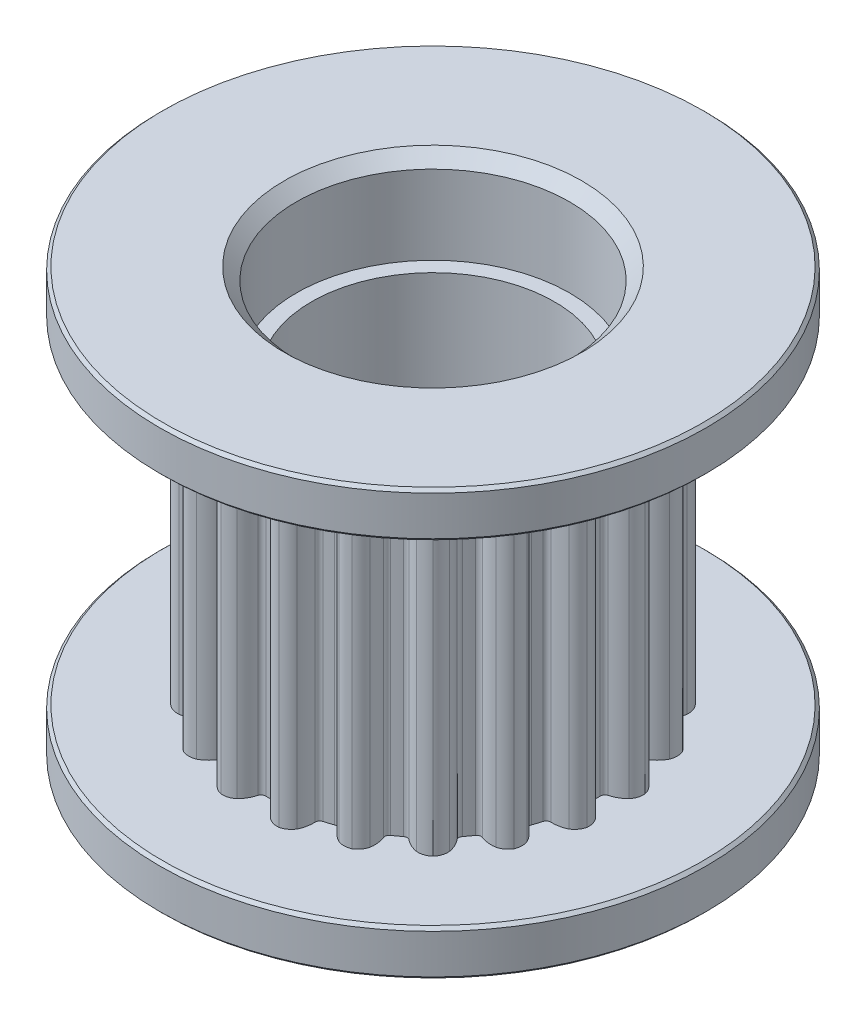
from build123d import *

# Parameters (mm, degrees)
GT2_PROFILE_REACH                 = 16.526
GT2_PROFILE_DIRECTION_2_REACH     = 16.526
GT2_GROOVE_CIRCULAR_PATTERN_COUNT = 20
INNER_CHAMFER_SIZE                = 0.4
OUTER_CHAMFER_SIZE                = 0.1


with BuildPart() as part:
    # Body Sketch → Body (revolve)
    with BuildSketch(Plane.XY, mode=Mode.PRIVATE) as body_sk:
        Polygon((6.11, -5.5), (6.11, 5.5), (9, 5.5), (9, 7), (4.5, 7), (4.5, 4), (4, 4), (4, -4), (4.5, -4), (4.5, -7), (9, -7), (9, -5.5), align=None)
    revolve(body_sk.sketch.rotate(Axis((0, 7, 0), (0, -1, 0)), 90), axis=Axis((0, 7, 0), (0, -1, 0)))

    # GT2 Profile: up to this face of the body (flat: up to its plane)
    gt2_profile_end = Plane(part.part.faces().sort_by_distance((0, -5.5, -8.745441559))[0])
    # GT2 Profile Sketch → GT2 Profile (cut, up to the picked face)
    with BuildSketch(Plane(origin=(0, 0, 0), x_dir=(1, 0, 0), z_dir=(0, 1, 0)), mode=Mode.PRIVATE) as gt2_profile_sk1:
        with BuildLine():
            ThreePointArc((0.299749921, -5.468781955), (0.244461347, -5.387479579), (0.150701934, -5.357881011))
            ThreePointArc((0.150701934, -5.357881011), (0, -5.36), (-0.150701934, -5.357881011))
            ThreePointArc((-0.150701934, -5.357881011), (-0.244461347, -5.387479579), (-0.299749921, -5.468781955))
            ThreePointArc((-0.299749921, -5.468781955), (-0.396626607, -5.703924717), (-0.549685833, -5.907025885))
            ThreePointArc((-0.549685833, -5.907025885), (-0.7593874, -6.016293358), (-0.995541542, -6.028349446))
            ThreePointArc((-0.995541542, -6.028349446), (0, -6.11), (0.995541542, -6.028349446))
            ThreePointArc((0.995541542, -6.028349446), (0.7593874, -6.016293358), (0.549685833, -5.907025885))
            ThreePointArc((0.549685833, -5.907025885), (0.396626607, -5.703924717), (0.299749921, -5.468781955))
        make_face()
    gt2_profile_tool1 = split(extrude(gt2_profile_sk1.sketch, amount=-GT2_PROFILE_REACH, mode=Mode.PRIVATE), bisect_by=gt2_profile_end, keep=Keep.BOTH, mode=Mode.PRIVATE)
    gt2_profile = gt2_profile_tool1.solids().sort_by(Axis((0, 0, 5.802237), (0, -1, 0)))[0]
    add(gt2_profile, mode=Mode.SUBTRACT)

    # GT2 Profile direction 2: up to this face of the body (flat: up to its plane)
    gt2_profile_direction_2_end = Plane(part.part.faces().sort_by_distance((0, 5.5, -6.364558441))[0])
    # GT2 Profile Sketch → GT2 Profile direction 2 (cut, up to the picked face)
    with BuildSketch(Plane(origin=(0, 0, 0), x_dir=(1, 0, 0), z_dir=(0, 1, 0)), mode=Mode.PRIVATE) as gt2_profile_direction_2_sk1:
        with BuildLine():
            ThreePointArc((0.299749921, -5.468781955), (0.244461347, -5.387479579), (0.150701934, -5.357881011))
            ThreePointArc((0.150701934, -5.357881011), (0, -5.36), (-0.150701934, -5.357881011))
            ThreePointArc((-0.150701934, -5.357881011), (-0.244461347, -5.387479579), (-0.299749921, -5.468781955))
            ThreePointArc((-0.299749921, -5.468781955), (-0.396626607, -5.703924717), (-0.549685833, -5.907025885))
            ThreePointArc((-0.549685833, -5.907025885), (-0.7593874, -6.016293358), (-0.995541542, -6.028349446))
            ThreePointArc((-0.995541542, -6.028349446), (0, -6.11), (0.995541542, -6.028349446))
            ThreePointArc((0.995541542, -6.028349446), (0.7593874, -6.016293358), (0.549685833, -5.907025885))
            ThreePointArc((0.549685833, -5.907025885), (0.396626607, -5.703924717), (0.299749921, -5.468781955))
        make_face()
    gt2_profile_direction_2_tool1 = split(extrude(gt2_profile_direction_2_sk1.sketch, amount=GT2_PROFILE_DIRECTION_2_REACH, mode=Mode.PRIVATE), bisect_by=gt2_profile_direction_2_end, keep=Keep.BOTH, mode=Mode.PRIVATE)
    gt2_profile_direction_2 = gt2_profile_direction_2_tool1.solids().sort_by(Axis((0, 0, 5.802237), (0, 1, 0)))[0]
    add(gt2_profile_direction_2, mode=Mode.SUBTRACT)

    # GT2 Groove Circular Pattern: GT2 Profile, GT2 Profile direction 2 ×20 about axis
    gt2_groove_circular_pattern_axis = Axis((0, 0, 0), (0, 1, 0))
    add([gt2_profile.rotate(gt2_groove_circular_pattern_axis, i * 360 / GT2_GROOVE_CIRCULAR_PATTERN_COUNT) for i in range(1, GT2_GROOVE_CIRCULAR_PATTERN_COUNT)], mode=Mode.SUBTRACT)
    add([gt2_profile_direction_2.rotate(gt2_groove_circular_pattern_axis, i * 360 / GT2_GROOVE_CIRCULAR_PATTERN_COUNT) for i in range(1, GT2_GROOVE_CIRCULAR_PATTERN_COUNT)], mode=Mode.SUBTRACT)

    # Inner Chamfer
    inner_chamfer_edges = [part.edges().sort_by_distance(p)[0] for p in [
        (0, -7, -4.5),
        (0, 7, -4.5),
    ]]
    chamfer(inner_chamfer_edges, length=INNER_CHAMFER_SIZE)

    # Outer Chamfer
    outer_chamfer_edges = [part.edges().sort_by_distance(p)[0] for p in [
        (0, 7, -9),
        (0, 5.5, -9),
        (0, -5.5, -9),
        (0, -7, -9),
    ]]
    chamfer(outer_chamfer_edges, length=OUTER_CHAMFER_SIZE)


solid = part.part
